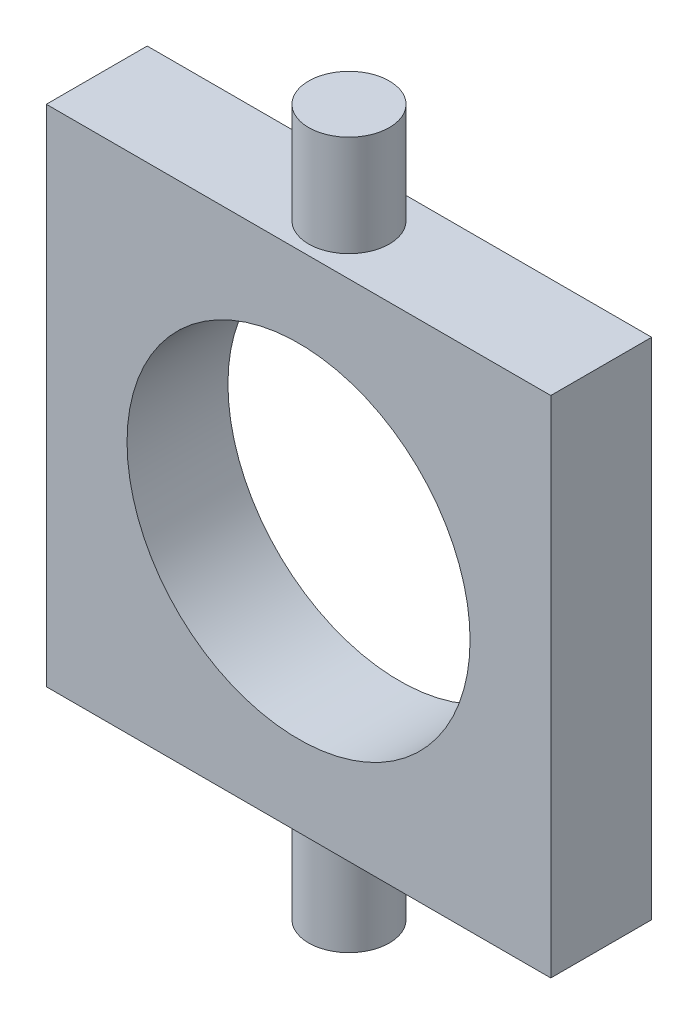
from build123d import *

# Parameters (mm, degrees)
SKETCH1_W           = 50
SKETCH1_H           = 50
BOSS_EXTRUDE1_DEPTH = 10
SKETCH2_R           = 17
CUT_EXTRUDE1_DEPTH  = 10
SKETCH3_R           = 4
BOSS_EXTRUDE2_DEPTH = 10


with BuildPart() as part:
    # Sketch1 → Boss-Extrude1 (new body)
    with BuildSketch(Plane.XY):
        Rectangle(SKETCH1_W, SKETCH1_H)
    extrude(amount=BOSS_EXTRUDE1_DEPTH)

    # Sketch2 → Cut-Extrude1 (cut)
    with BuildSketch(Plane.XY.offset(10)):
        Circle(SKETCH2_R)
    extrude(amount=-CUT_EXTRUDE1_DEPTH, mode=Mode.SUBTRACT)

    # Sketch3 → Boss-Extrude2 (add)
    with BuildSketch(Plane(origin=(0, 25, 0), x_dir=(1, 0, 0), z_dir=(0, 1, 0))):
        with Locations(Location((0, -5, 0), (0, 0, 270))):
            Circle(SKETCH3_R)
    boss_extrude2 = extrude(amount=BOSS_EXTRUDE2_DEPTH)

    # Mirror1: Boss-Extrude2 across plane
    add(boss_extrude2.mirror(Plane.ZX))


solid = part.part
